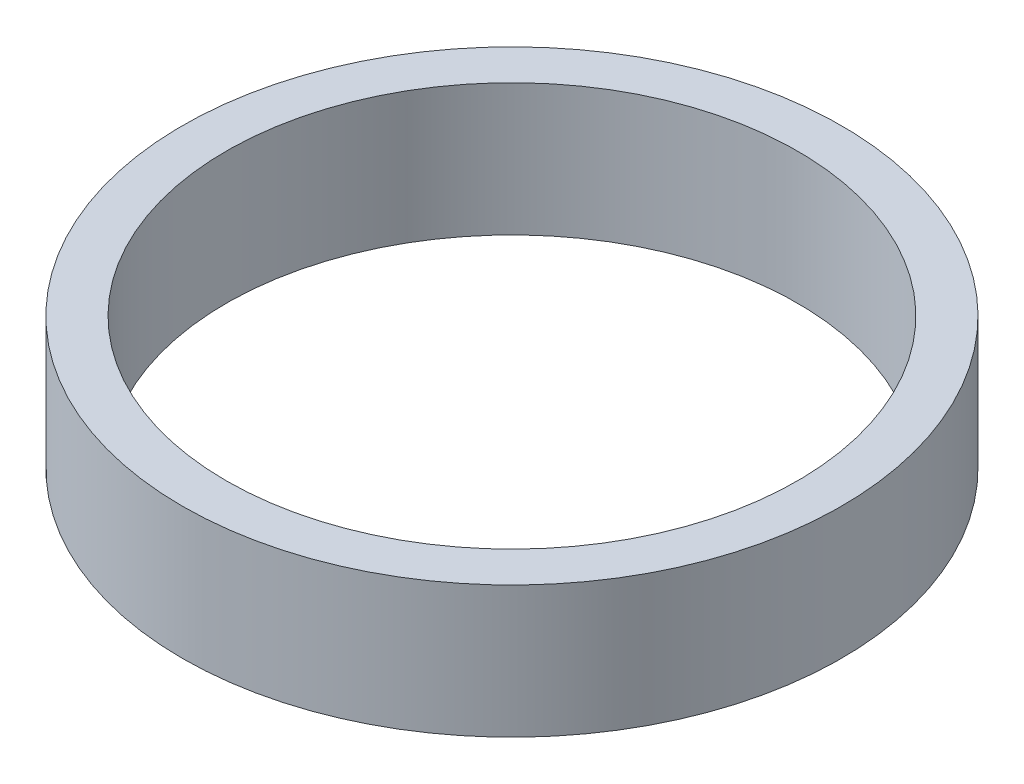
from build123d import *

# Parameters (mm, degrees)
SKETCH1_R           = 7.5
SKETCH1_R_2         = 6.5
BOSS_EXTRUDE1_DEPTH = 3


with BuildPart() as part:
    # Sketch1 → Boss-Extrude1 (new body)
    with BuildSketch(Plane(origin=(0, 0, 0), x_dir=(1, 0, 0), z_dir=(0, 1, 0))):
        with Locations(Location((0, 0, 0), (0, 0, 270))):
            Circle(SKETCH1_R)
        with Locations(Location((0, 0, 0), (0, 0, 270))):
            Circle(SKETCH1_R_2, mode=Mode.SUBTRACT)
    extrude(amount=BOSS_EXTRUDE1_DEPTH)


solid = part.part
